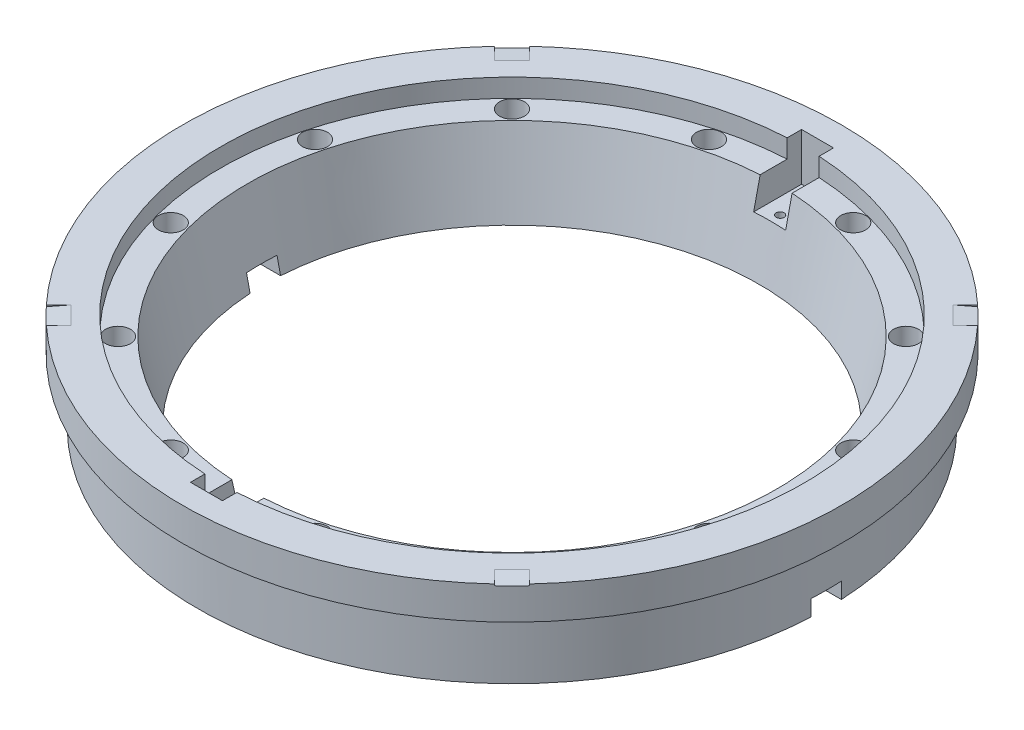
from build123d import *

# Parameters (mm, degrees)
CUT_EXTRUDE_1_REACH = 475.247
SKETCH_2_R          = 8.5
SKETCH_3_R          = 12.5
CUT_EXTRUDE_2_DEPTH = 18
SKETCH_4_W          = 32
SKETCH_4_H          = 49.5
CUT_EXTRUDE_3_DEPTH = 47.5
CUT_EXTRUDE_4_REACH = 471.308
SKETCH_7_R          = 4
SKETCH_8_W          = 131
SKETCH_8_H          = 30.5
CUT_EXTRUDE_5_DEPTH = 16
CUT_REVOLVE_1_ANGLE = 5
CUT_REVOLVE_3_ANGLE = 5
CUT_REVOLVE_4_ANGLE = 5
CUT_REVOLVE_5_ANGLE = 5


with BuildPart() as part:
    # 草图1 → 旋转1 (revolve)
    with BuildSketch(Plane.XY):
        Polygon((-330, 0), (-292, 0), (-292, -18.5), (-265, -18.5), (-247.5, -97), (-315, -97), (-315, -37.02), (-330, -33), align=None)
    revolve(axis=Axis((0, 0, 0), (0, 1, 0)))

    # 草图2 → 切除-拉伸1 (cut, up to next)
    with BuildSketch(Plane(origin=(0, -18.5, 0), x_dir=(1, 0, 0), z_dir=(0, 1, 0)), mode=Mode.PRIVATE) as cut_extrude_1_sk1:
        with Locations((-72.210513584, 269.493305535)):
            Circle(SKETCH_2_R)
    cut_extrude_1_tool1 = extrude(cut_extrude_1_sk1.sketch, amount=-CUT_EXTRUDE_1_REACH, mode=Mode.PRIVATE) & part.part
    # 草图2 → 切除-拉伸1 (cut, up to next)
    with BuildSketch(Plane(origin=(0, -18.5, 0), x_dir=(1, 0, 0), z_dir=(0, 1, 0)), mode=Mode.PRIVATE) as cut_extrude_1_sk2:
        with Locations((72.210513584, 269.493305535)):
            Circle(SKETCH_2_R)
    cut_extrude_1_tool2 = extrude(cut_extrude_1_sk2.sketch, amount=-CUT_EXTRUDE_1_REACH, mode=Mode.PRIVATE) & part.part
    # 草图2 → 切除-拉伸1 (cut, up to next)
    with BuildSketch(Plane(origin=(0, -18.5, 0), x_dir=(1, 0, 0), z_dir=(0, 1, 0)), mode=Mode.PRIVATE) as cut_extrude_1_sk3:
        with Locations((197.282791951, 197.282791951)):
            Circle(SKETCH_2_R)
    cut_extrude_1_tool3 = extrude(cut_extrude_1_sk3.sketch, amount=-CUT_EXTRUDE_1_REACH, mode=Mode.PRIVATE) & part.part
    # 草图2 → 切除-拉伸1 (cut, up to next)
    with BuildSketch(Plane(origin=(0, -18.5, 0), x_dir=(1, 0, 0), z_dir=(0, 1, 0)), mode=Mode.PRIVATE) as cut_extrude_1_sk4:
        with Locations((269.493305535, 72.210513584)):
            Circle(SKETCH_2_R)
    cut_extrude_1_tool4 = extrude(cut_extrude_1_sk4.sketch, amount=-CUT_EXTRUDE_1_REACH, mode=Mode.PRIVATE) & part.part
    # 草图2 → 切除-拉伸1 (cut, up to next)
    with BuildSketch(Plane(origin=(0, -18.5, 0), x_dir=(1, 0, 0), z_dir=(0, 1, 0)), mode=Mode.PRIVATE) as cut_extrude_1_sk5:
        with Locations((269.493305535, -72.210513584)):
            Circle(SKETCH_2_R)
    cut_extrude_1_tool5 = extrude(cut_extrude_1_sk5.sketch, amount=-CUT_EXTRUDE_1_REACH, mode=Mode.PRIVATE) & part.part
    # 草图2 → 切除-拉伸1 (cut, up to next)
    with BuildSketch(Plane(origin=(0, -18.5, 0), x_dir=(1, 0, 0), z_dir=(0, 1, 0)), mode=Mode.PRIVATE) as cut_extrude_1_sk6:
        with Locations((197.282791951, -197.282791951)):
            Circle(SKETCH_2_R)
    cut_extrude_1_tool6 = extrude(cut_extrude_1_sk6.sketch, amount=-CUT_EXTRUDE_1_REACH, mode=Mode.PRIVATE) & part.part
    # 草图2 → 切除-拉伸1 (cut, up to next)
    with BuildSketch(Plane(origin=(0, -18.5, 0), x_dir=(1, 0, 0), z_dir=(0, 1, 0)), mode=Mode.PRIVATE) as cut_extrude_1_sk7:
        with Locations((72.210513584, -269.493305535)):
            Circle(SKETCH_2_R)
    cut_extrude_1_tool7 = extrude(cut_extrude_1_sk7.sketch, amount=-CUT_EXTRUDE_1_REACH, mode=Mode.PRIVATE) & part.part
    # 草图2 → 切除-拉伸1 (cut, up to next)
    with BuildSketch(Plane(origin=(0, -18.5, 0), x_dir=(1, 0, 0), z_dir=(0, 1, 0)), mode=Mode.PRIVATE) as cut_extrude_1_sk8:
        with Locations((-72.210513584, -269.493305535)):
            Circle(SKETCH_2_R)
    cut_extrude_1_tool8 = extrude(cut_extrude_1_sk8.sketch, amount=-CUT_EXTRUDE_1_REACH, mode=Mode.PRIVATE) & part.part
    # 草图2 → 切除-拉伸1 (cut, up to next)
    with BuildSketch(Plane(origin=(0, -18.5, 0), x_dir=(1, 0, 0), z_dir=(0, 1, 0)), mode=Mode.PRIVATE) as cut_extrude_1_sk9:
        with Locations((-197.282791951, -197.282791951)):
            Circle(SKETCH_2_R)
    cut_extrude_1_tool9 = extrude(cut_extrude_1_sk9.sketch, amount=-CUT_EXTRUDE_1_REACH, mode=Mode.PRIVATE) & part.part
    # 草图2 → 切除-拉伸1 (cut, up to next)
    with BuildSketch(Plane(origin=(0, -18.5, 0), x_dir=(1, 0, 0), z_dir=(0, 1, 0)), mode=Mode.PRIVATE) as cut_extrude_1_sk10:
        with Locations((-269.493305535, -72.210513584)):
            Circle(SKETCH_2_R)
    cut_extrude_1_tool10 = extrude(cut_extrude_1_sk10.sketch, amount=-CUT_EXTRUDE_1_REACH, mode=Mode.PRIVATE) & part.part
    # 草图2 → 切除-拉伸1 (cut, up to next)
    with BuildSketch(Plane(origin=(0, -18.5, 0), x_dir=(1, 0, 0), z_dir=(0, 1, 0)), mode=Mode.PRIVATE) as cut_extrude_1_sk11:
        with Locations((-269.493305535, 72.210513584)):
            Circle(SKETCH_2_R)
    cut_extrude_1_tool11 = extrude(cut_extrude_1_sk11.sketch, amount=-CUT_EXTRUDE_1_REACH, mode=Mode.PRIVATE) & part.part
    # 草图2 → 切除-拉伸1 (cut, up to next)
    with BuildSketch(Plane(origin=(0, -18.5, 0), x_dir=(1, 0, 0), z_dir=(0, 1, 0)), mode=Mode.PRIVATE) as cut_extrude_1_sk12:
        with Locations((-197.282791951, 197.282791951)):
            Circle(SKETCH_2_R)
    cut_extrude_1_tool12 = extrude(cut_extrude_1_sk12.sketch, amount=-CUT_EXTRUDE_1_REACH, mode=Mode.PRIVATE) & part.part
    add(cut_extrude_1_tool1.solids().sort_by_distance((-72.210514, -18.5, -269.493306))[0], mode=Mode.SUBTRACT)
    add(cut_extrude_1_tool2.solids().sort_by_distance((72.210514, -18.5, -269.493306))[0], mode=Mode.SUBTRACT)
    add(cut_extrude_1_tool3.solids().sort_by_distance((197.282792, -18.5, -197.282792))[0], mode=Mode.SUBTRACT)
    add(cut_extrude_1_tool4.solids().sort_by_distance((269.493306, -18.5, -72.210514))[0], mode=Mode.SUBTRACT)
    add(cut_extrude_1_tool5.solids().sort_by_distance((269.493306, -18.5, 72.210514))[0], mode=Mode.SUBTRACT)
    add(cut_extrude_1_tool6.solids().sort_by_distance((197.282792, -18.5, 197.282792))[0], mode=Mode.SUBTRACT)
    add(cut_extrude_1_tool7.solids().sort_by_distance((72.210514, -18.5, 269.493306))[0], mode=Mode.SUBTRACT)
    add(cut_extrude_1_tool8.solids().sort_by_distance((-72.210514, -18.5, 269.493306))[0], mode=Mode.SUBTRACT)
    add(cut_extrude_1_tool9.solids().sort_by_distance((-197.282792, -18.5, 197.282792))[0], mode=Mode.SUBTRACT)
    add(cut_extrude_1_tool10.solids().sort_by_distance((-269.493306, -18.5, 72.210514))[0], mode=Mode.SUBTRACT)
    add(cut_extrude_1_tool11.solids().sort_by_distance((-269.493306, -18.5, -72.210514))[0], mode=Mode.SUBTRACT)
    add(cut_extrude_1_tool12.solids().sort_by_distance((-197.282792, -18.5, -197.282792))[0], mode=Mode.SUBTRACT)

    # 草图3 → 切除-拉伸2 (cut)
    with BuildSketch(Plane(origin=(0, -18.5, 0), x_dir=(1, 0, 0), z_dir=(0, 1, 0))):
        with Locations((-72.210513584, 269.493305535)):
            Circle(SKETCH_3_R)
        with Locations((72.210513584, 269.493305535)):
            Circle(SKETCH_3_R)
        with Locations((197.282791951, 197.282791951)):
            Circle(SKETCH_3_R)
        with Locations((269.493305535, 72.210513584)):
            Circle(SKETCH_3_R)
        with Locations((269.493305535, -72.210513584)):
            Circle(SKETCH_3_R)
        with Locations((197.282791951, -197.282791951)):
            Circle(SKETCH_3_R)
        with Locations((72.210513584, -269.493305535)):
            Circle(SKETCH_3_R)
        with Locations((-72.210513584, -269.493305535)):
            Circle(SKETCH_3_R)
        with Locations((-197.282791951, -197.282791951)):
            Circle(SKETCH_3_R)
        with Locations((-269.493305535, -72.210513584)):
            Circle(SKETCH_3_R)
        with Locations((-269.493305535, 72.210513584)):
            Circle(SKETCH_3_R)
        with Locations((-197.282791951, 197.282791951)):
            Circle(SKETCH_3_R)
    extrude(amount=-CUT_EXTRUDE_2_DEPTH, mode=Mode.SUBTRACT)

    # 草图4 → 切除-拉伸3 (cut)
    with BuildSketch(Plane(origin=(0, 0, 0), x_dir=(1, 0, 0), z_dir=(0, 1, 0))):
        with Locations((0, 281.25)):
            Rectangle(SKETCH_4_W, SKETCH_4_H)
        with Locations((0, -281.25)):
            Rectangle(SKETCH_4_W, SKETCH_4_H)
    extrude(amount=-CUT_EXTRUDE_3_DEPTH, mode=Mode.SUBTRACT)

    # 草图7 → 切除-拉伸4 (cut, up to next)
    with BuildSketch(Plane(origin=(0, -47.5, 0), x_dir=(1, 0, 0), z_dir=(0, 1, 0)), mode=Mode.PRIVATE) as cut_extrude_4_sk1:
        with Locations((0, 295.519729782)):
            Circle(SKETCH_7_R)
    cut_extrude_4_tool1 = extrude(cut_extrude_4_sk1.sketch, amount=-CUT_EXTRUDE_4_REACH, mode=Mode.PRIVATE) & part.part
    # 草图7 → 切除-拉伸4 (cut, up to next)
    with BuildSketch(Plane(origin=(0, -47.5, 0), x_dir=(1, 0, 0), z_dir=(0, 1, 0)), mode=Mode.PRIVATE) as cut_extrude_4_sk2:
        with Locations((0, 268.519729782)):
            Circle(SKETCH_7_R)
    cut_extrude_4_tool2 = extrude(cut_extrude_4_sk2.sketch, amount=-CUT_EXTRUDE_4_REACH, mode=Mode.PRIVATE) & part.part
    # 草图7 → 切除-拉伸4 (cut, up to next)
    with BuildSketch(Plane(origin=(0, -47.5, 0), x_dir=(1, 0, 0), z_dir=(0, 1, 0)), mode=Mode.PRIVATE) as cut_extrude_4_sk3:
        with Locations((0, -268.519729782)):
            Circle(SKETCH_7_R)
    cut_extrude_4_tool3 = extrude(cut_extrude_4_sk3.sketch, amount=-CUT_EXTRUDE_4_REACH, mode=Mode.PRIVATE) & part.part
    # 草图7 → 切除-拉伸4 (cut, up to next)
    with BuildSketch(Plane(origin=(0, -47.5, 0), x_dir=(1, 0, 0), z_dir=(0, 1, 0)), mode=Mode.PRIVATE) as cut_extrude_4_sk4:
        with Locations((0, -295.519729782)):
            Circle(SKETCH_7_R)
    cut_extrude_4_tool4 = extrude(cut_extrude_4_sk4.sketch, amount=-CUT_EXTRUDE_4_REACH, mode=Mode.PRIVATE) & part.part
    add(cut_extrude_4_tool1.solids().sort_by_distance((0, -47.5, -295.51973))[0], mode=Mode.SUBTRACT)
    add(cut_extrude_4_tool2.solids().sort_by_distance((0, -47.5, -268.51973))[0], mode=Mode.SUBTRACT)
    add(cut_extrude_4_tool3.solids().sort_by_distance((0, -47.5, 268.51973))[0], mode=Mode.SUBTRACT)
    add(cut_extrude_4_tool4.solids().sort_by_distance((0, -47.5, 295.51973))[0], mode=Mode.SUBTRACT)

    # 草图8 → 切除-拉伸5 (cut)
    with BuildSketch(Plane.XZ.offset(97)):
        with Locations((285.5, 0)):
            Rectangle(SKETCH_8_W, SKETCH_8_H)
        with Locations((-285.5, 0)):
            Rectangle(SKETCH_8_W, SKETCH_8_H)
    extrude(amount=-CUT_EXTRUDE_5_DEPTH, mode=Mode.SUBTRACT)

    # 草图9 → 切除-旋转1 (revolve, cut)
    with BuildSketch(Plane(origin=(0, 0, 0), x_dir=(1, 0, 0), z_dir=(0, 1, 0))):
        Polygon((-237.834010658, 255.511680188), (-255.511680188, 237.834010658), (-229.563996686, 211.886327157), (-211.886327157, 229.563996686), align=None)
    revolve(axis=Axis((-211.886327157, 0, -229.563996686), (-0.7071067811865481, 0, 0.707106781186547)), revolution_arc=CUT_REVOLVE_1_ANGLE, mode=Mode.SUBTRACT)

    # 草图9<3> → 切除-旋转3 (revolve, cut)
    with BuildSketch(Plane(origin=(0, 0, 0), x_dir=(1, 0, 0), z_dir=(0, 1, 0))):
        Polygon((255.511680188, 237.834010658), (237.834010658, 255.511680188), (211.886327157, 229.563996686), (229.563996686, 211.886327157), align=None)
    revolve(axis=Axis((229.563996686, 0, -211.886327157), (-0.7071067811865481, 0, -0.707106781186547)), revolution_arc=CUT_REVOLVE_3_ANGLE, mode=Mode.SUBTRACT)

    # 草图9<4> → 切除-旋转4 (revolve, cut)
    with BuildSketch(Plane(origin=(0, 0, 0), x_dir=(1, 0, 0), z_dir=(0, 1, 0))):
        Polygon((237.834010658, -255.511680188), (255.511680188, -237.834010658), (229.563996686, -211.886327156), (211.886327157, -229.563996686), align=None)
    revolve(axis=Axis((211.886327157, 0, 229.563996686), (0.7071067811865481, 0, -0.707106781186547)), revolution_arc=CUT_REVOLVE_4_ANGLE, mode=Mode.SUBTRACT)

    # 草图9<5> → 切除-旋转5 (revolve, cut)
    with BuildSketch(Plane(origin=(0, 0, 0), x_dir=(1, 0, 0), z_dir=(0, 1, 0))):
        Polygon((-255.511680188, -237.834010658), (-237.834010658, -255.511680188), (-211.886327156, -229.563996686), (-229.563996686, -211.886327157), align=None)
    revolve(axis=Axis((-229.563996686, 0, 211.886327157), (0.7071067811865481, 0, 0.707106781186547)), revolution_arc=CUT_REVOLVE_5_ANGLE, mode=Mode.SUBTRACT)


solid = part.part
